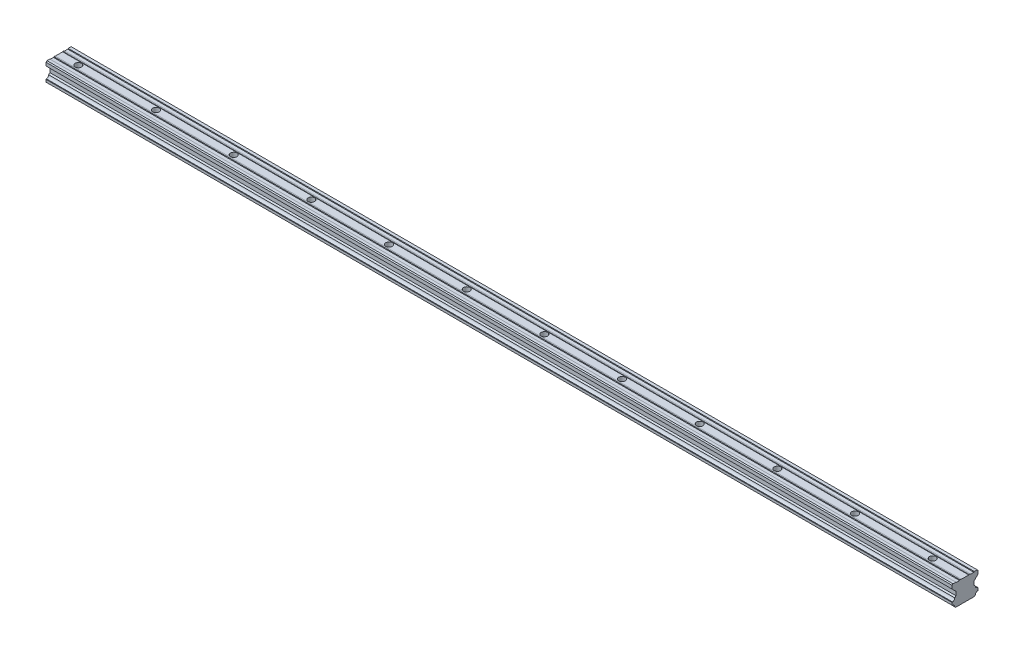
from build123d import *

# Parameters (mm, degrees)
BOSS_EXTRUDE1_DEPTH   = 700
CROQUIS1_R            = 2.5
CORTAR_EXTRUIR1_DEPTH = 20
MATRIZL1_COUNT        = 12
MATRIZL1_PITCH        = 60


with BuildPart() as part:
    # Sketch1 → Boss-Extrude1 (new body)
    with BuildSketch(Plane(origin=(0, 0, 0), x_dir=(0, 0, -1), z_dir=(1, 0, 0))):
        with BuildLine():
            Line((-7.965754986, -7.693975449), (-7.266272068, -8.393458366))
            Line((-7.266272068, -8.393458366), (7.266272068, -8.393458366))
            Line((7.266272068, -8.393458366), (7.965754986, -7.693975449))
            ThreePointArc((7.965754986, -7.693975449), (8.474723757, -6.421557866), (9.747437917, -5.913331162))
            Line((9.747437917, -5.913331162), (10.000000437, -5.660768637))
            Line((10.000000437, -5.660768637), (10.000000437, -3.788406023))
            Line((10.000000437, -3.788406023), (9.747437912, -3.535843503))
            ThreePointArc((9.747437912, -3.535843503), (8.462742055, -3.016656911), (7.965755402, -1.72321096))
            Line((7.965755402, -1.72321096), (7.005148341, -0.762603918))
            Line((7.005148341, -0.762603918), (7.005148341, 2.166206023))
            Line((7.005148341, 2.166206023), (10.000000347, 5.161058089))
            Line((10.000000347, 5.161058089), (10.000000347, 7.712387211))
            Line((10.000000347, 7.712387211), (9.408464779, 8.393458268))
            Line((9.408464779, 8.393458268), (7.133016457, 8.393458268))
            Line((7.133016457, 8.393458268), (6.789534443, 8.049976247))
            Line((6.789534443, 8.049976247), (4.271139656, 8.049976247))
            Line((4.271139656, 8.049976247), (3.927707784, 8.393458265))
            Line((3.927707784, 8.393458265), (3.061282509, 8.393458265))
            Line((3.061282509, 8.393458265), (2.872049327, 8.204225079))
            Line((2.872049327, 8.204225079), (-2.87204886, 8.204225079))
            Line((-2.87204886, 8.204225079), (-3.061282046, 8.393458261))
            Line((-3.061282046, 8.393458261), (-3.927707321, 8.393458261))
            Line((-3.927707321, 8.393458261), (-4.271189216, 8.049976359))
            Line((-4.271189216, 8.049976359), (-6.789534095, 8.049976359))
            Line((-6.789534095, 8.049976359), (-7.133016116, 8.393458373))
            Line((-7.133016116, 8.393458373), (-9.30771733, 8.393458373))
            Line((-9.30771733, 8.393458373), (-10, 7.70117569))
            Line((-10, 7.70117569), (-10, 5.161058187))
            Line((-10, 5.161058187), (-7.005147934, 2.166206181))
            Line((-7.005147934, 2.166206181), (-7.005147934, -0.76260376))
            Line((-7.005147934, -0.76260376), (-7.965754986, -1.723210812))
            ThreePointArc((-7.965754986, -1.723210812), (-8.462741848, -3.016656549), (-9.747437477, -3.535843372))
            Line((-9.747437477, -3.535843372), (-10, -3.788405895))
            Line((-10, -3.788405895), (-10, -5.660768509))
            Line((-10, -5.660768509), (-9.747437477, -5.913331032))
            ThreePointArc((-9.747437477, -5.913331032), (-8.474723558, -6.421557943), (-7.965754986, -7.693975449))
        make_face()
    extrude(amount=BOSS_EXTRUDE1_DEPTH)

    # Croquis1 → Cortar-Extruir1 (cut)
    with BuildSketch(Plane.XZ.offset(8.393458366)):
        with Locations(Location((15, 0, 0), (0, 0, 270))):
            Circle(CROQUIS1_R)
    cortar_extruir1 = extrude(amount=-CORTAR_EXTRUIR1_DEPTH, mode=Mode.SUBTRACT)

    # MatrizL1: Cortar-Extruir1 ×12
    with Locations(*[(i * MATRIZL1_PITCH, 0, 0) for i in range(1, MATRIZL1_COUNT)]):
        add(cortar_extruir1, mode=Mode.SUBTRACT)


solid = part.part
